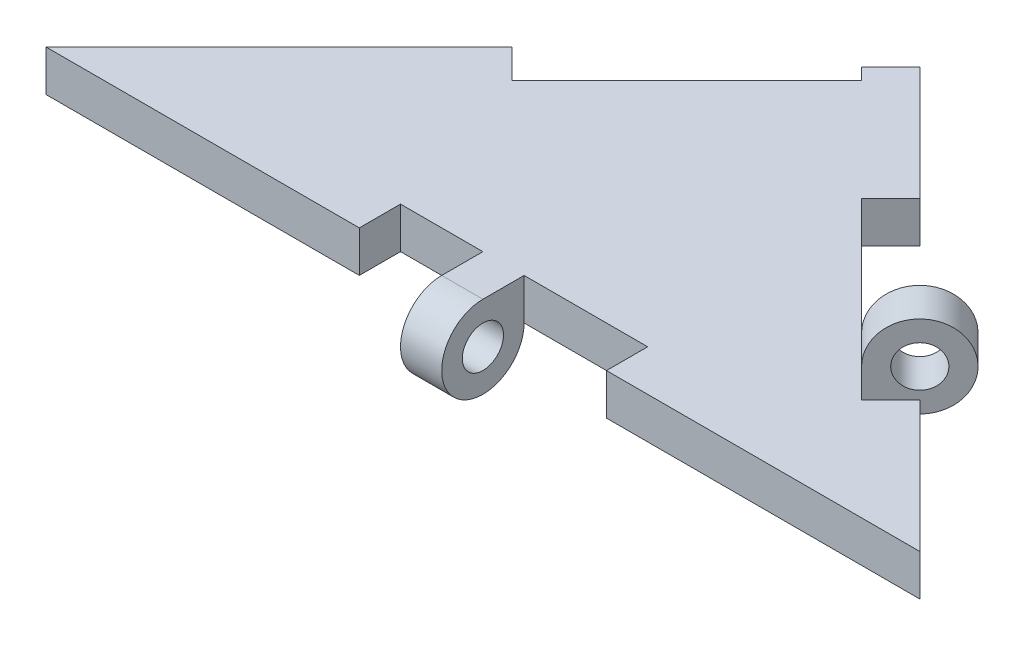
from build123d import *

# Parameters (mm, degrees)
BOSS_EXTRUDE1_DEPTH = 5
SKETCH2_W           = 30
SKETCH2_H           = 5
CUT_EXTRUDE1_DEPTH  = 5
CUT_EXTRUDE2_DEPTH  = 5
BOSS_EXTRUDE2_START = 15
SKETCH5_R           = 2.5
BOSS_EXTRUDE2_DEPTH = 5
BOSS_EXTRUDE3_START = 5
SKETCH6_R           = 2.5
BOSS_EXTRUDE3_DEPTH = 5
CUT_EXTRUDE3_DEPTH  = 10


with BuildPart() as part:
    # Sketch1 → Boss-Extrude1 (new body)
    with BuildSketch(Plane(origin=(0, 0, 0), x_dir=(1, 0, 0), z_dir=(0, 1, 0))):
        Polygon((-53.033008589, 0), (53.033008589, 0), (0, 53.033008589), align=None)
    extrude(amount=BOSS_EXTRUDE1_DEPTH)

    # Sketch2 → Cut-Extrude1 (cut)
    with BuildSketch(Plane(origin=(0, 5, 0), x_dir=(1, 0, 0), z_dir=(0, 1, 0))):
        with Locations((0, 2.5)):
            Rectangle(SKETCH2_W, SKETCH2_H)
        Polygon((-3.535533906, 49.497474683), (-24.748737342, 28.284271247), (-21.213203436, 24.748737342), (0, 45.961940777), align=None)
    extrude(amount=-CUT_EXTRUDE1_DEPTH, mode=Mode.SUBTRACT)

    # Sketch3 → Cut-Extrude2 (cut)
    with BuildSketch(Plane.XZ):
        Polygon((15.909902577, -37.123106012), (37.123106012, -15.909902577), (33.587572106, -12.374368671), (12.374368671, -33.587572106), align=None)
    extrude(amount=-CUT_EXTRUDE2_DEPTH, mode=Mode.SUBTRACT)

    # Sketch5 → Boss-Extrude2 (add)
    with BuildSketch(Plane.ZY.offset(-15).offset(BOSS_EXTRUDE2_START)):
        with BuildLine():
            Line((0, 5), (-5, 5))
            Line((-5, 5), (-5, 0))
            ThreePointArc((-5, 0), (3.535533906, -3.535533906), (0, 5))
        make_face()
        Circle(SKETCH5_R, mode=Mode.SUBTRACT)
    extrude(amount=BOSS_EXTRUDE2_DEPTH)

    # Sketch6 → Boss-Extrude3 (add)
    with BuildSketch(Plane(origin=(10.606601718, 0, 10.606601718), x_dir=(-0.7071067811865478, 0, 0.7071067811865472), z_dir=(-0.7071067811865472, 0, -0.7071067811865478)).offset(BOSS_EXTRUDE3_START)):
        with BuildLine():
            ThreePointArc((-32.5, 5), (-41.035533906, 8.535533906), (-37.5, 0))
            Line((-37.5, 0), (-32.5, 0))
            Line((-32.5, 0), (-32.5, 5))
        make_face()
        with Locations((-37.5, 5)):
            Circle(SKETCH6_R, mode=Mode.SUBTRACT)
    extrude(amount=BOSS_EXTRUDE3_DEPTH)

    # Sketch7 → Cut-Extrude3 (cut)
    with BuildSketch(Plane(origin=(0, 5, 0), x_dir=(1, 0, 0), z_dir=(0, 1, 0))):
        Polygon((0, 53.033008589), (-19.038130038, 33.994878551), (-16.916809694, 31.873558208), (2.121320344, 50.911688245), align=None)
    extrude(amount=-CUT_EXTRUDE3_DEPTH, mode=Mode.SUBTRACT)


solid = part.part
